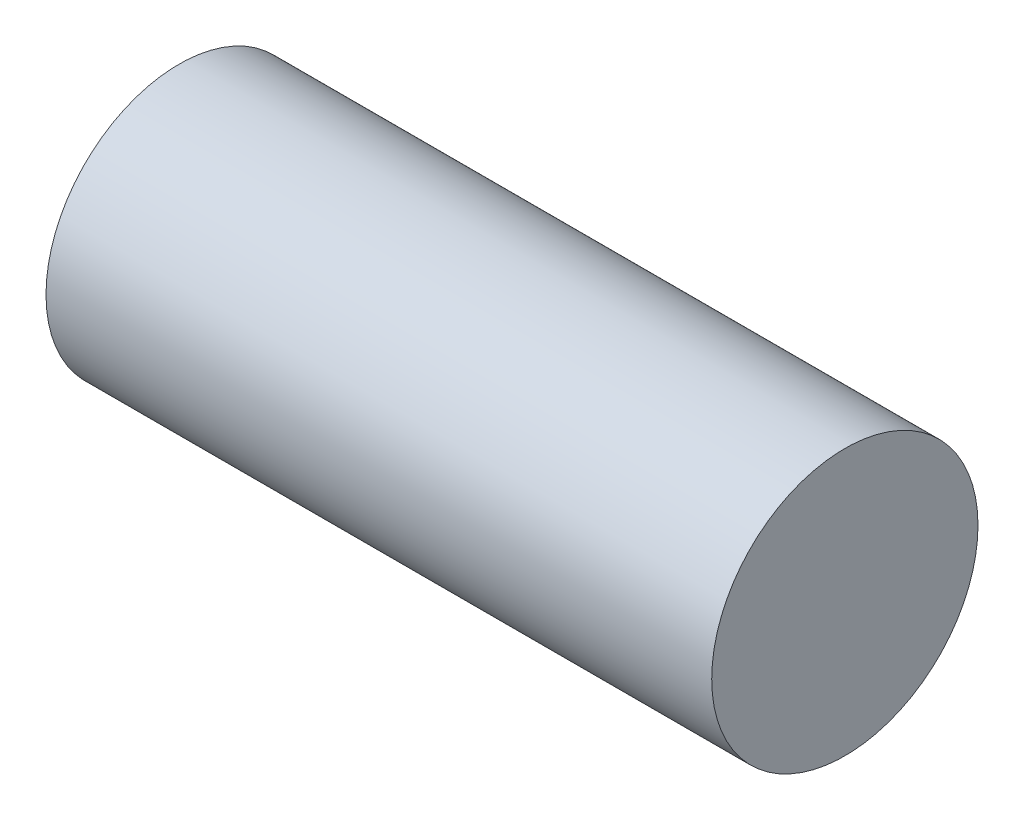
from build123d import *

# Parameters (mm, degrees)
SKETCH1_R           = 5
BOSS_EXTRUDE1_DEPTH = 12.5


with BuildPart() as part:
    # Sketch1 → Boss-Extrude1 (new, symmetric)
    with BuildSketch(Plane.YZ):
        with Locations(Location((0, 0, 0), (0, 0, 270))):
            Circle(SKETCH1_R)
    extrude(amount=BOSS_EXTRUDE1_DEPTH, both=True)


solid = part.part
